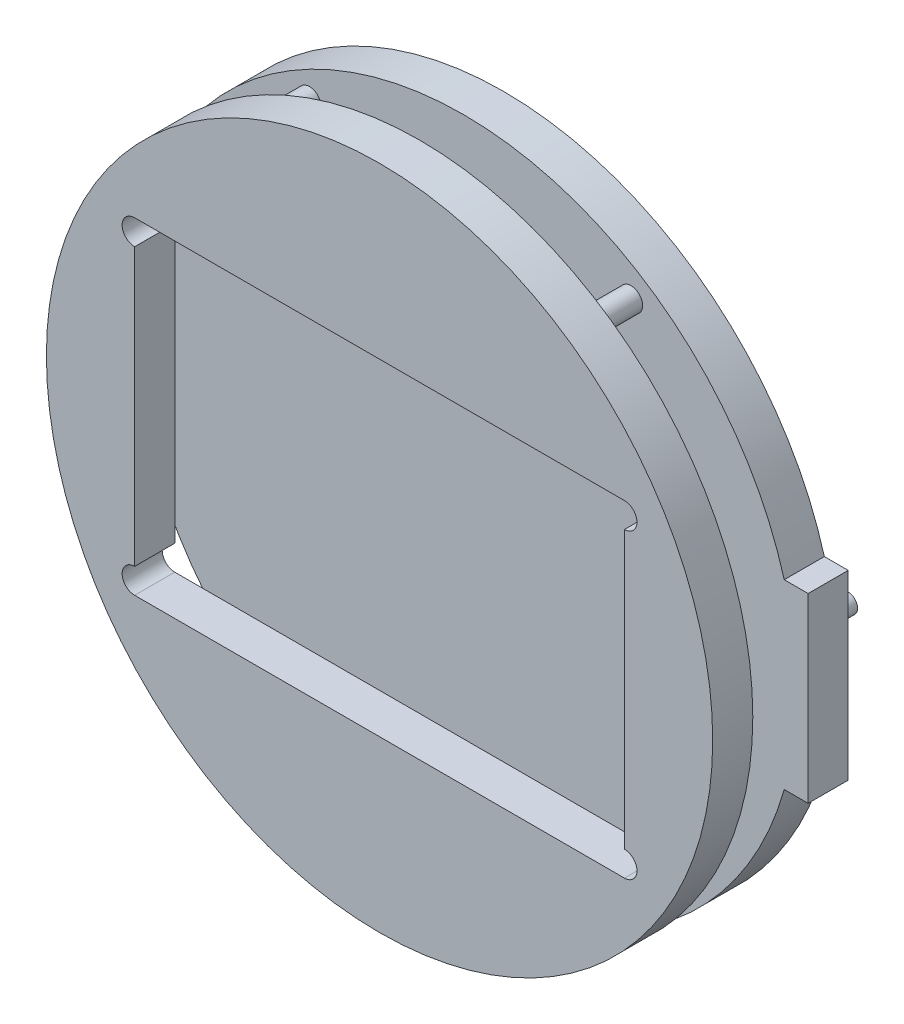
from build123d import *

# Parameters (mm, degrees)
SKETCH5_R           = 13.505404748
BOSS_EXTRUDE1_DEPTH = 1.6256
SKETCH6_W           = 19.854
SKETCH6_H           = 13.254
CUT_EXTRUDE1_DEPTH  = 20.168580808
SKETCH7_R           = 0.508
CUT_EXTRUDE2_DEPTH  = 20.168580808
SKETCH9_R           = 0.467957387
SKETCH9_R_2         = 0.471151672
SKETCH9_R_3         = 0.612350227
BOSS_EXTRUDE2_DEPTH = 1.778
SKETCH10_R          = 13.5128
BOSS_EXTRUDE3_DEPTH = 1.6256
SKETCH11_W          = 27.94
SKETCH11_H          = 7.366
BOSS_EXTRUDE4_DEPTH = 1.6256
SKETCH12_R          = 0.381
BOSS_EXTRUDE5_DEPTH = 2.54


with BuildPart() as part:
    # Sketch5 → Boss-Extrude1 (new body)
    with BuildSketch(Plane.XY):
        Circle(SKETCH5_R)
    extrude(amount=BOSS_EXTRUDE1_DEPTH)

    # Sketch6 → Cut-Extrude1 (cut, through all)
    with BuildSketch(Plane.XY.offset(1.6256)):
        Rectangle(SKETCH6_W, SKETCH6_H)
    extrude(amount=-CUT_EXTRUDE1_DEPTH, mode=Mode.SUBTRACT)

    # Sketch7 → Cut-Extrude2 (cut, through all)
    with BuildSketch(Plane.XY.offset(1.6256)):
        with Locations((-9.927, 6.119)):
            Circle(SKETCH7_R)
        with Locations((-9.927, -6.119)):
            Circle(SKETCH7_R)
        with Locations((9.927, -6.119)):
            Circle(SKETCH7_R)
        with Locations((9.927, 6.119)):
            Circle(SKETCH7_R)
    extrude(amount=-CUT_EXTRUDE2_DEPTH, mode=Mode.SUBTRACT)

    # Sketch9 → Boss-Extrude2 (add)
    with BuildSketch(Plane(origin=(0, 0, 0), x_dir=(-1, 0, 0), z_dir=(0, 0, -1))):
        with Locations(Location((-6.791513401, 10.433736314, 0), (0, 0, 180))):
            Circle(SKETCH9_R)
        with Locations(Location((6.243810708, 10.901693701, 0), (0, 0, 180))):
            Circle(SKETCH9_R_2)
        with Locations(Location((5.422256667, -10.76235793, 0), (0, 0, 180))):
            Circle(SKETCH9_R_3)
        with Locations(Location((-6.791513401, -10.150007703, 0), (0, 0, 180))):
            Circle(SKETCH9_R_3)
    extrude(amount=BOSS_EXTRUDE2_DEPTH)

    # Sketch10 → Boss-Extrude3 (add)
    with BuildSketch(Plane(origin=(0, 0, -1.778), x_dir=(-1, 0, 0), z_dir=(0, 0, -1))):
        Circle(SKETCH10_R)
    extrude(amount=BOSS_EXTRUDE3_DEPTH)

    # Sketch11 → Boss-Extrude4 (add)
    with BuildSketch(Plane(origin=(0, 0, -3.4036), x_dir=(-1, 0, 0), z_dir=(0, 0, -1))):
        Rectangle(SKETCH11_W, SKETCH11_H)
    extrude(amount=-BOSS_EXTRUDE4_DEPTH)

    # Sketch12 → Boss-Extrude5 (add)
    with BuildSketch(Plane(origin=(0, 0, -3.4036), x_dir=(-1, 0, 0), z_dir=(0, 0, -1))):
        with Locations((-11.43, 0)):
            Circle(SKETCH12_R)
        with Locations(Location((11.43, 0, 0), (0, 0, 180))):
            Circle(SKETCH12_R)
    extrude(amount=BOSS_EXTRUDE5_DEPTH)


solid = part.part
